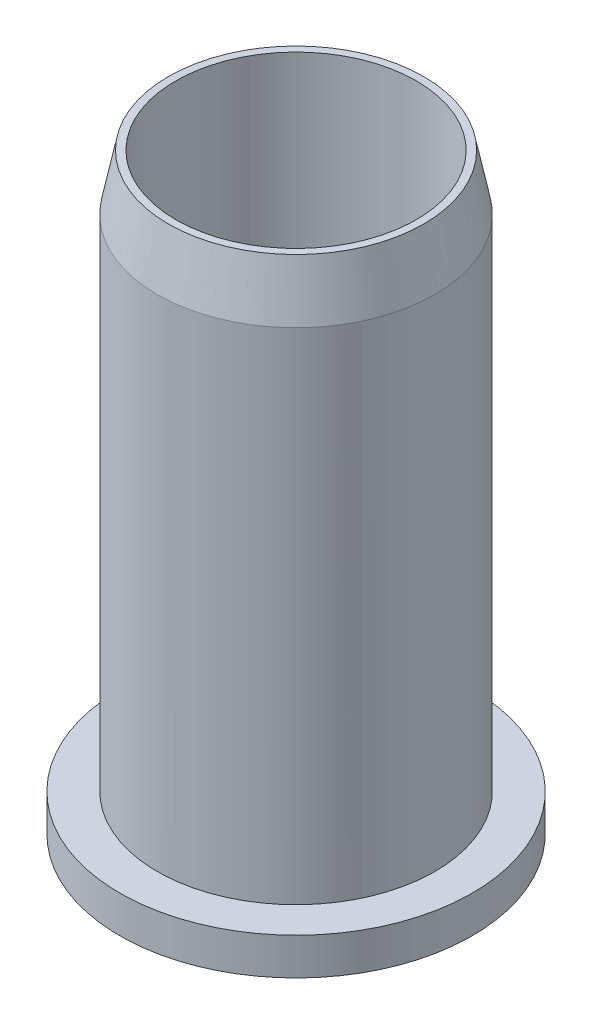
from build123d import *

# Parameters (mm, degrees)
CHAMFER_1_SIZE  = 0.3
CHAMFER_1_SIZE2 = 1.5


with BuildPart() as part:
    # 草图1 → 旋转1 (revolve)
    with BuildSketch(Plane.XY, mode=Mode.PRIVATE) as revolve_1_sk:
        Polygon((3.25, 16), (3.75, 16), (3.75, 1), (4.76, 1), (4.76, 0), (3.25, 0), align=None)
    revolve(revolve_1_sk.sketch.rotate(Axis((0, 0, 0), (0, 1, 0)), 90), axis=Axis((0, 0, 0), (0, 1, 0)))

    # 倒角1
    chamfer_1_edges = [part.edges().sort_by_distance(p)[0] for p in [
        (0, 16, 3.75),
    ]]
    chamfer_1_side = [part.faces().sort_by_distance(p)[0] for p in [
        (0, 16, 3.356066017),
    ]]
    chamfer(chamfer_1_edges, length=CHAMFER_1_SIZE, length2=CHAMFER_1_SIZE2, reference=chamfer_1_side[0])


solid = part.part
